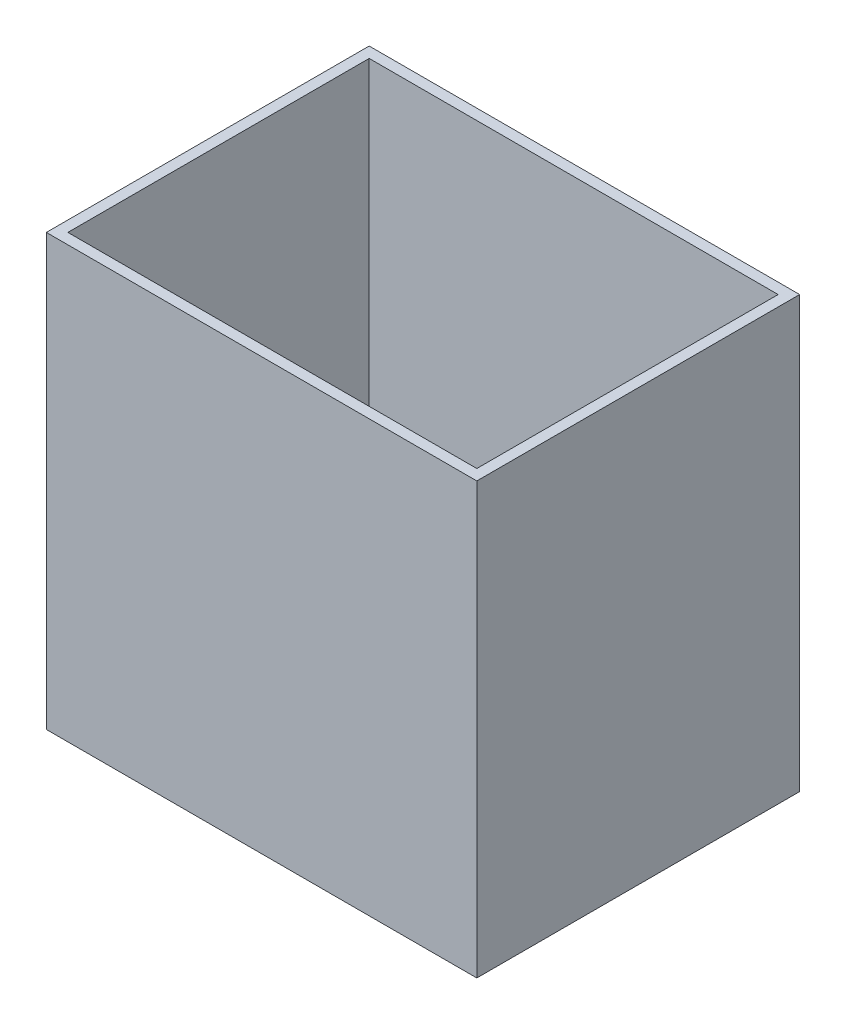
from build123d import *

# Parameters (mm, degrees)
SKETCH_1_W      = 80
SKETCH_1_H      = 60
EXTRUDE_1_DEPTH = 80
SHELL_1_T       = -2


with BuildPart() as part:
    # 草图1 → 凸台-拉伸1 (new body)
    with BuildSketch(Plane(origin=(0, 0, 0), x_dir=(1, 0, 0), z_dir=(0, 1, 0))):
        with Locations((40, 30)):
            Rectangle(SKETCH_1_W, SKETCH_1_H)
    extrude(amount=EXTRUDE_1_DEPTH)

    # 抽壳1
    shell_1_openings = [part.faces().sort_by_distance(p)[0] for p in [
        (40, 80, -30),
    ]]
    offset(amount=SHELL_1_T, openings=shell_1_openings, kind=Kind.INTERSECTION)


solid = part.part
